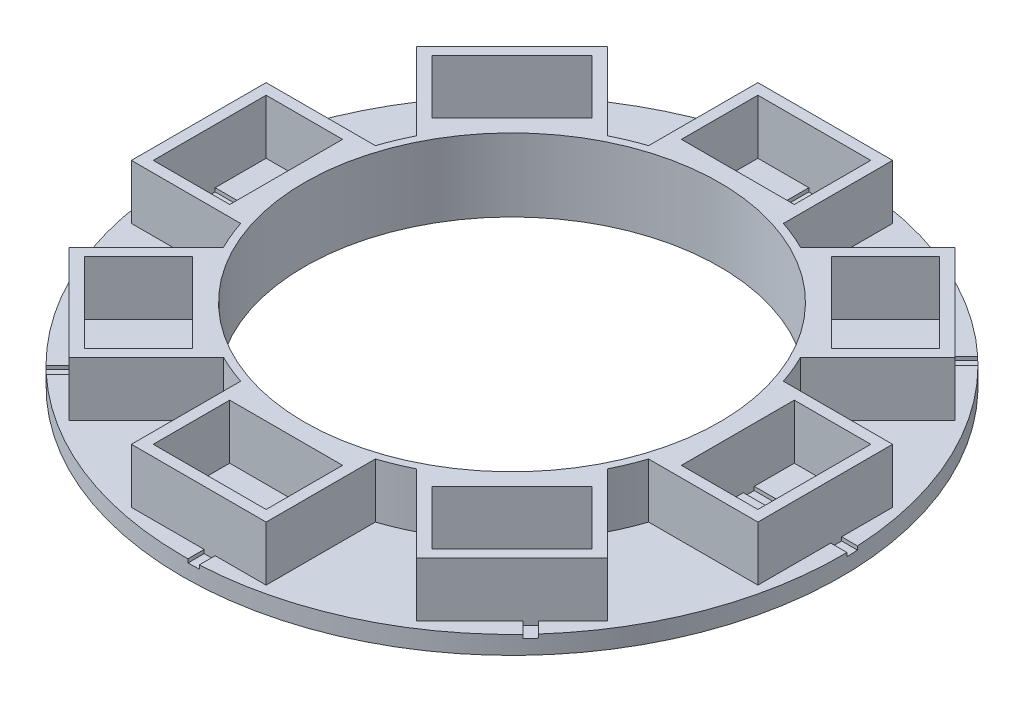
from build123d import *

# Parameters (mm, degrees)
SKETCH3_W                       = 56
SKETCH3_H                       = 3
SKETCH3_W_2                     = 3
SKETCH3_H_2                     = 56
CUT_EXTRUDE1_DEPTH              = 1
BOSS_EXTRUDE1_REACH             = 130.862
SKETCH4_W                       = 31
SKETCH4_H                       = 21
BOSS_EXTRUDE1_DIRECTION_2_REACH = 130.862
CIRPATTERN1_COUNT               = 8


with BuildPart() as part:
    # Sketch2 → Revolve1 (revolve)
    with BuildSketch(Plane(origin=(0, 0, 0), x_dir=(0, 0, -1), z_dir=(1, 0, 0))):
        Polygon((-90.5, 4.121863799), (-57, 4.121863799), (-57, 6.121863799), (-57, 24.121863799), (-59, 24.121863799), (-59, 9.121863799), (-90.5, 9.121863799), align=None)
    revolve(axis=Axis((0, 80.23297491, 0), (0, -1, 0)))

    # Sketch3 → Cut-Extrude1 (cut)
    with BuildSketch(Plane(origin=(0, 9.121863799, 0), x_dir=(1, 0, 0), z_dir=(0, 1, 0))):
        with Locations((-86.980929121, 0)):
            Rectangle(SKETCH3_W, SKETCH3_H)
        Polygon((-82.985966376, 81.743596048), (-80.864646033, 83.864916391), (-41.266666286, 44.266936645), (-43.38798663, 42.145616301), align=None)
        with Locations((0, 89.981852183)):
            Rectangle(SKETCH3_W_2, SKETCH3_H_2)
        Polygon((81.743596048, 85.986889438), (83.864916391, 83.865569094), (44.266936645, 44.267589348), (42.145616301, 46.388909691), align=None)
        with Locations((89.981852183, 3.000923062)):
            Rectangle(SKETCH3_W, SKETCH3_H)
        Polygon((85.986889438, -78.742672986), (83.865569094, -80.86399333), (44.267589348, -41.266013583), (46.388909691, -39.14469324), align=None)
        with Locations((3.000923062, -86.980929121)):
            Rectangle(SKETCH3_W_2, SKETCH3_H_2)
        Polygon((-78.742672986, -82.985966376), (-80.86399333, -80.864646033), (-41.266013583, -41.266666286), (-39.14469324, -43.38798663), align=None)
    extrude(amount=-CUT_EXTRUDE1_DEPTH, mode=Mode.SUBTRACT)

    # Boss-Extrude1: up to this face of the body (flat: up to its plane)
    boss_extrude1_end = Plane(part.part.faces().sort_by_distance((0, 24.121863799, -58.668772004))[0])
    # Sketch4 → Boss-Extrude1 (add, up to the picked face)
    with BuildSketch(Plane(origin=(0, 9.121863799, 0), x_dir=(1, 0, 0), z_dir=(0, 1, 0)), mode=Mode.PRIVATE) as boss_extrude1_sk1:
        with BuildLine():
            Line((18.5, 86.03), (18.5, 59.03))
            Line((18.5, 59.03), (18.5, 55.707696119))
            ThreePointArc((18.5, 55.707696119), (0, 58.209424556), (-18.5, 55.707696119))
            Line((-18.5, 55.707696119), (-18.5, 59.03))
            Line((-18.5, 59.03), (-18.5, 86.03))
            Line((-18.5, 86.03), (18.5, 86.03))
        make_face()
        with Locations((0, 72.53)):
            Rectangle(SKETCH4_W, SKETCH4_H, mode=Mode.SUBTRACT)
    boss_extrude1_tool1 = split(extrude(boss_extrude1_sk1.sketch, amount=BOSS_EXTRUDE1_REACH, mode=Mode.PRIVATE), bisect_by=boss_extrude1_end, keep=Keep.BOTH, mode=Mode.PRIVATE)
    boss_extrude1 = boss_extrude1_tool1.solids().sort_by(Axis((18.021623, 9.121864, -72.53), (0, 1, 0)))[0]
    add(boss_extrude1)

    # Boss-Extrude1 direction 2: up to this face of the body (flat: up to its plane)
    boss_extrude1_direction_2_end = Plane(part.part.faces().sort_by_distance((-52.938409817, 8.121863799, -53.817117102))[0])
    # Sketch4 → Boss-Extrude1 direction 2 (add, up to the picked face)
    with BuildSketch(Plane(origin=(0, 9.121863799, 0), x_dir=(1, 0, 0), z_dir=(0, 1, 0)), mode=Mode.PRIVATE) as boss_extrude1_direction_2_sk1:
        with BuildLine():
            Line((18.5, 86.03), (18.5, 59.03))
            Line((18.5, 59.03), (18.5, 55.707696119))
            ThreePointArc((18.5, 55.707696119), (0, 58.209424556), (-18.5, 55.707696119))
            Line((-18.5, 55.707696119), (-18.5, 59.03))
            Line((-18.5, 59.03), (-18.5, 86.03))
            Line((-18.5, 86.03), (18.5, 86.03))
        make_face()
        with Locations((0, 72.53)):
            Rectangle(SKETCH4_W, SKETCH4_H, mode=Mode.SUBTRACT)
    boss_extrude1_direction_2_tool1 = split(extrude(boss_extrude1_direction_2_sk1.sketch, amount=-BOSS_EXTRUDE1_DIRECTION_2_REACH, mode=Mode.PRIVATE), bisect_by=boss_extrude1_direction_2_end, keep=Keep.BOTH, mode=Mode.PRIVATE)
    boss_extrude1_direction_2 = boss_extrude1_direction_2_tool1.solids().sort_by(Axis((18.021623, 9.121864, -72.53), (0, -1, 0)))[0]
    add(boss_extrude1_direction_2)

    # CirPattern1: Boss-Extrude1, Boss-Extrude1 direction 2 ×8 about axis
    cirpattern1_axis = Axis((0, 0, 0), (0, 1, 0))
    add([boss_extrude1.rotate(cirpattern1_axis, i * 360 / CIRPATTERN1_COUNT) for i in range(1, CIRPATTERN1_COUNT)])
    add([boss_extrude1_direction_2.rotate(cirpattern1_axis, i * 360 / CIRPATTERN1_COUNT) for i in range(1, CIRPATTERN1_COUNT)])


solid = part.part
